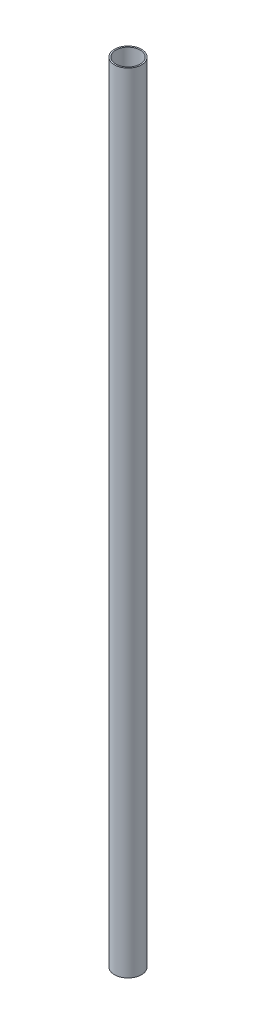
from build123d import *

# Parameters (mm, degrees)
SKETCH1_R = 5
SHELL1_T  = -0.5


with BuildPart() as part:
    # Sweep1: sweep along a path in Sketch2
    with BuildLine(Plane.XY) as sweep1_path:
        Line((0, 0), (0, 291))
    # Sketch1 → Sweep1 (sweep)
    with BuildSketch(Plane(origin=(0, 0, 0), x_dir=(1, 0, 0), z_dir=(0, 1, 0))):
        Circle(SKETCH1_R)
    sweep(path=sweep1_path.line)

    # Shell1
    shell1_openings = [part.faces().sort_by_distance(p)[0] for p in [
        (0, 291, 0),
        (0, 0, 0),
    ]]
    offset(amount=SHELL1_T, openings=shell1_openings, kind=Kind.INTERSECTION)


solid = part.part
